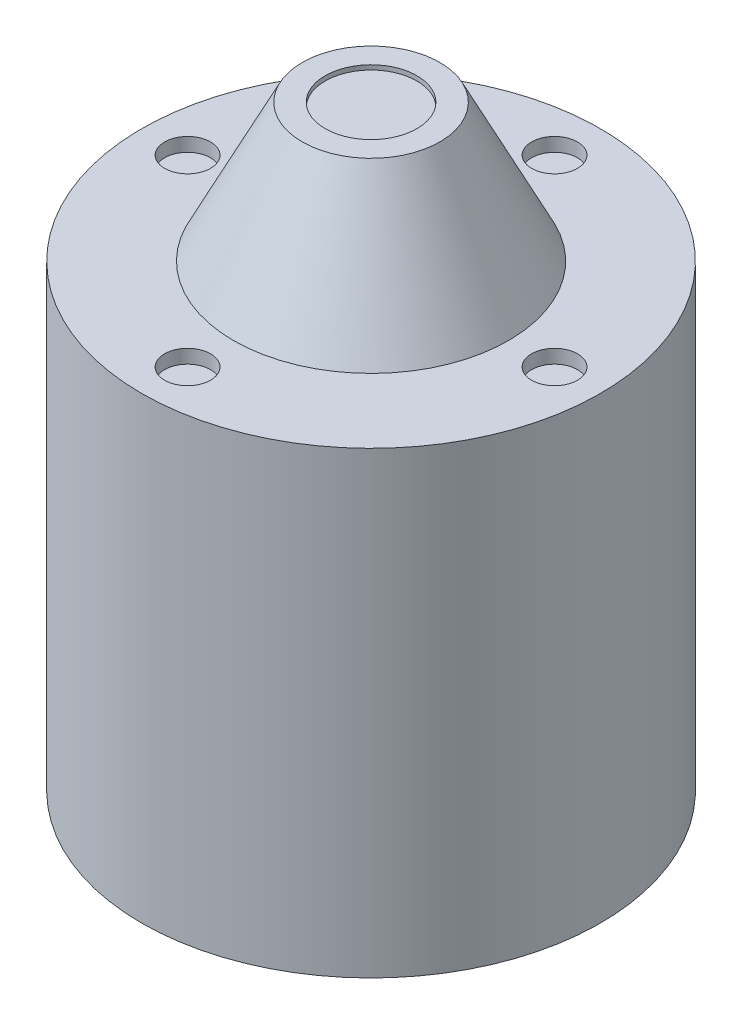
from build123d import *

# Parameters (mm, degrees)
SKETCH1_R           = 25
BOSS_EXTRUDE1_DEPTH = 50
SKETCH3_R           = 7.5
SKETCH4_R           = 15
SKETCH5_R           = 5
CUT_EXTRUDE1_DEPTH  = 0.5
CUT_EXTRUDE2_START  = -15
SKETCH5_4_R         = 2.5
CUT_EXTRUDE2_DEPTH  = 1.5


with BuildPart() as part:
    # Sketch1 → Boss-Extrude1 (new body)
    with BuildSketch(Plane(origin=(0, 0, 0), x_dir=(1, 0, 0), z_dir=(0, 1, 0))):
        with Locations(Location((0, 0, 0), (0, 0, 270))):
            Circle(SKETCH1_R)
    extrude(amount=BOSS_EXTRUDE1_DEPTH)

    # Sketch3 → Loft1 section 0
    with BuildSketch(Plane(origin=(0, 65, 0), x_dir=(1, 0, 0), z_dir=(0, 1, 0))):
        Circle(SKETCH3_R)
    # Sketch4 → Loft1 section 1
    with BuildSketch(Plane(origin=(0, 50, 0), x_dir=(1, 0, 0), z_dir=(0, 1, 0))):
        Circle(SKETCH4_R)
    loft()

    # Sketch5 → Cut-Extrude1 (cut)
    with BuildSketch(Plane(origin=(0, 65, 0), x_dir=(1, 0, 0), z_dir=(0, 1, 0))):
        with Locations(Location((0, 0, 0), (0, 0, 270))):
            Circle(SKETCH5_R)
    extrude(amount=-CUT_EXTRUDE1_DEPTH, mode=Mode.SUBTRACT)

    # Sketch5<4> → Cut-Extrude2 (cut)
    with BuildSketch(Plane(origin=(0, 65, 0), x_dir=(1, 0, 0), z_dir=(0, 1, 0)).offset(CUT_EXTRUDE2_START)):
        with Locations(Location((-20, 0, 0), (0, 0, 270))):
            Circle(SKETCH5_4_R)
        with Locations(Location((0, 20, 0), (0, 0, 270))):
            Circle(SKETCH5_4_R)
        with Locations(Location((20, 0, 0), (0, 0, 270))):
            Circle(SKETCH5_4_R)
        with Locations(Location((0, -20, 0), (0, 0, 270))):
            Circle(SKETCH5_4_R)
    extrude(amount=-CUT_EXTRUDE2_DEPTH, mode=Mode.SUBTRACT)


solid = part.part
